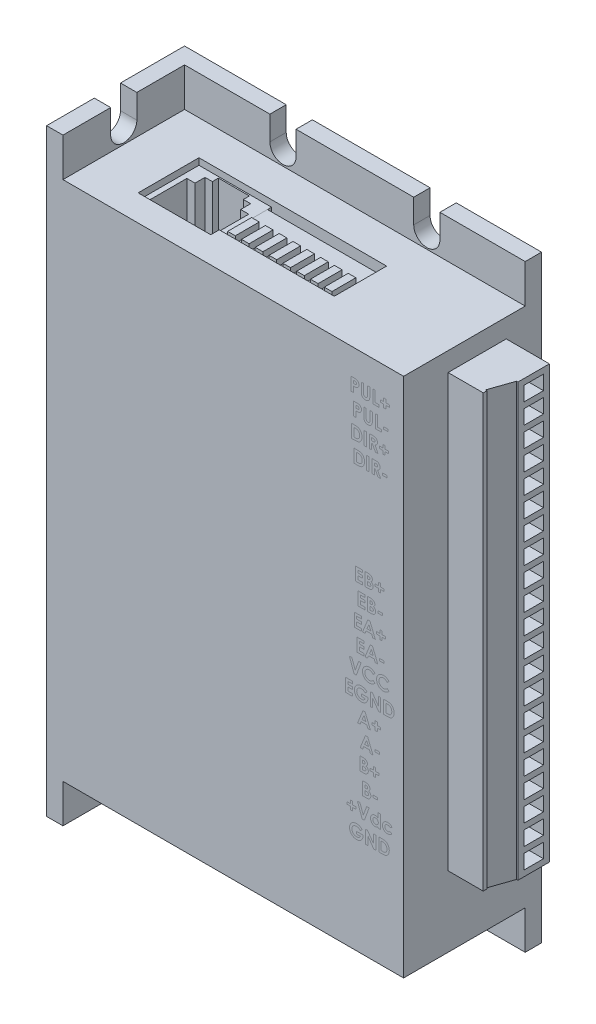
from build123d import *

# Parameters (mm, degrees)
SKETCH1_W             = 69.342
SKETCH1_H             = 116.205
BOSS_EXTRUDE1_DEPTH   = 26.797
SKETCH2_W             = 66.167
SKETCH2_H             = 7.493
CUT_EXTRUDE1_DEPTH    = 23.622
CUT_EXTRUDE2_DEPTH    = 93.043748317
CUT_EXTRUDE3_DEPTH    = 72.665735406
SKETCH5_W             = 14.097
SKETCH5_H             = 11.811
CUT_EXTRUDE4_DEPTH    = 12.7
SKETCH6_W             = 22.352
SKETCH6_H             = 10.16
CUT_EXTRUDE5_DEPTH    = 2.54
SKETCH7_W             = 22.352
SKETCH7_H             = 9.365891057
BOSS_EXTRUDE2_DEPTH   = 1.27
SKETCH8_W             = 1.48713728
SKETCH8_H             = 4.653093647
BOSS_EXTRUDE3_DEPTH   = 1.27
SKETCH8_W_2           = 1.487137279
BOSS_EXTRUDE3_2_DEPTH = 1.27
BOSS_EXTRUDE3_3_DEPTH = 1.27
BOSS_EXTRUDE3_4_DEPTH = 1.27
BOSS_EXTRUDE3_5_DEPTH = 1.27
BOSS_EXTRUDE3_6_DEPTH = 1.27
BOSS_EXTRUDE3_7_DEPTH = 1.27
BOSS_EXTRUDE3_8_DEPTH = 1.27
SKETCH9_W             = 14.097
SKETCH9_H             = 11.811
BOSS_EXTRUDE4_DEPTH   = 11.43
SKETCH10_W            = 11.303
SKETCH10_H            = 83.82
CUT_EXTRUDE6_DEPTH    = 5.08
BOSS_EXTRUDE5_DEPTH   = 83.82
SKETCH12_W            = 3.81
SKETCH12_H            = 2.794
CUT_EXTRUDE7_DEPTH    = 5.08


with BuildPart() as part:
    # Sketch1 → Boss-Extrude1 (new body)
    with BuildSketch(Plane.XY):
        Rectangle(SKETCH1_W, SKETCH1_H)
    extrude(amount=BOSS_EXTRUDE1_DEPTH)

    # Sketch2 → Cut-Extrude1 (cut)
    with BuildSketch(Plane.XY.offset(26.797)):
        with Locations((1.5875, 54.356)):
            Rectangle(SKETCH2_W, SKETCH2_H)
        with Locations((1.5875, -54.356)):
            Rectangle(SKETCH2_W, SKETCH2_H)
    extrude(amount=-CUT_EXTRUDE1_DEPTH, mode=Mode.SUBTRACT)

    # Sketch3 → Cut-Extrude2 (cut, through all)
    with BuildSketch(Plane(origin=(-31.496, 0, 0), x_dir=(0, 0, -1), z_dir=(1, 0, 0))):
        with BuildLine():
            Line((-12.446, 62.764217528), (-12.446, 53.440782472))
            ThreePointArc((-12.446, 53.440782472), (-14.986, 50.900782472), (-17.526, 53.440782472))
            Line((-17.526, 53.440782472), (-17.526, 62.764217528))
            ThreePointArc((-17.526, 62.764217528), (-14.986, 65.304217528), (-12.446, 62.764217528))
        make_face()
        with BuildLine():
            Line((-12.446, -62.764217528), (-12.446, -53.440782472))
            ThreePointArc((-12.446, -53.440782472), (-14.986, -50.900782472), (-17.526, -53.440782472))
            Line((-17.526, -53.440782472), (-17.526, -62.764217528))
            ThreePointArc((-17.526, -62.764217528), (-14.986, -65.304217528), (-12.446, -62.764217528))
        make_face()
    extrude(amount=-CUT_EXTRUDE2_DEPTH, mode=Mode.SUBTRACT)

    # Sketch4 → Cut-Extrude3 (cut, through all)
    with BuildSketch(Plane.XY.offset(3.175)):
        with BuildLine():
            Line((-9.8425, 62.7634), (-9.8425, 53.4416))
            ThreePointArc((-9.8425, 53.4416), (-12.3825, 50.9016), (-14.9225, 53.4416))
            Line((-14.9225, 53.4416), (-14.9225, 62.7634))
            ThreePointArc((-14.9225, 62.7634), (-12.3825, 65.3034), (-9.8425, 62.7634))
        make_face()
        with BuildLine():
            Line((13.0175, 62.7634), (13.0175, 53.4416))
            ThreePointArc((13.0175, 53.4416), (15.5575, 50.9016), (18.0975, 53.4416))
            Line((18.0975, 53.4416), (18.0975, 62.7634))
            ThreePointArc((18.0975, 62.7634), (15.5575, 65.3034), (13.0175, 62.7634))
        make_face()
        with BuildLine():
            Line((13.0175, -62.7634), (13.0175, -53.4416))
            ThreePointArc((13.0175, -53.4416), (15.5575, -50.9016), (18.0975, -53.4416))
            Line((18.0975, -53.4416), (18.0975, -62.7634))
            ThreePointArc((18.0975, -62.7634), (15.5575, -65.3034), (13.0175, -62.7634))
        make_face()
        with BuildLine():
            Line((-9.8425, -62.7634), (-9.8425, -53.4416))
            ThreePointArc((-9.8425, -53.4416), (-12.3825, -50.9016), (-14.9225, -53.4416))
            Line((-14.9225, -53.4416), (-14.9225, -62.7634))
            ThreePointArc((-14.9225, -62.7634), (-12.3825, -65.3034), (-9.8425, -62.7634))
        make_face()
    extrude(amount=-CUT_EXTRUDE3_DEPTH, mode=Mode.SUBTRACT)

    # Sketch5 → Cut-Extrude4 (cut)
    with BuildSketch(Plane(origin=(0, 50.6095, 0), x_dir=(1, 0, 0), z_dir=(0, 1, 0))):
        with Locations((-14.9225, -15.8115)):
            Rectangle(SKETCH5_W, SKETCH5_H)
    extrude(amount=-CUT_EXTRUDE4_DEPTH, mode=Mode.SUBTRACT)

    # Sketch6 → Cut-Extrude5 (cut)
    with BuildSketch(Plane(origin=(0, 50.6095, 0), x_dir=(1, 0, 0), z_dir=(0, 1, 0))):
        with Locations((3.302, -14.986)):
            Rectangle(SKETCH6_W, SKETCH6_H)
    extrude(amount=-CUT_EXTRUDE5_DEPTH, mode=Mode.SUBTRACT)

    # Sketch10 → Cut-Extrude6 (cut)
    with BuildSketch(Plane(origin=(34.671, 0, 0), x_dir=(0, 0, -1), z_dir=(1, 0, 0))):
        with Locations((-12.5095, 5.0165)):
            Rectangle(SKETCH10_W, SKETCH10_H)
    extrude(amount=-CUT_EXTRUDE6_DEPTH, mode=Mode.SUBTRACT)


with BuildPart() as body_2:
    # Sketch7 → Boss-Extrude2 (new body)
    with BuildSketch(Plane(origin=(0, 48.0695, 0), x_dir=(1, 0, 0), z_dir=(0, 1, 0))):
        with Locations((3.302, -15.383054472)):
            Rectangle(SKETCH7_W, SKETCH7_H)
    extrude(amount=BOSS_EXTRUDE2_DEPTH)


with BuildPart() as body_3:
    # Sketch8 → Boss-Extrude3 (new body)
    with BuildSketch(Plane(origin=(0, 49.3395, 0), x_dir=(1, 0, 0), z_dir=(0, 1, 0))):
        with Locations((-3.375429754, -17.178323812)):
            Rectangle(SKETCH8_W, SKETCH8_H)
    extrude(amount=BOSS_EXTRUDE3_DEPTH)


with BuildPart() as body_4:
    # Sketch8 → Boss-Extrude3 2 (new body)
    with BuildSketch(Plane(origin=(0, 49.3395, 0), x_dir=(1, 0, 0), z_dir=(0, 1, 0))):
        with Locations((-6.056553119, -17.178323812)):
            Rectangle(SKETCH8_W_2, SKETCH8_H)
    extrude(amount=BOSS_EXTRUDE3_2_DEPTH)


with BuildPart() as body_5:
    # Sketch8 → Boss-Extrude3 3 (new body)
    with BuildSketch(Plane(origin=(0, 49.3395, 0), x_dir=(1, 0, 0), z_dir=(0, 1, 0))):
        with Locations((-0.694306389, -17.178323812)):
            Rectangle(SKETCH8_W, SKETCH8_H)
    extrude(amount=BOSS_EXTRUDE3_3_DEPTH)


with BuildPart() as body_6:
    # Sketch8 → Boss-Extrude3 4 (new body)
    with BuildSketch(Plane(origin=(0, 49.3395, 0), x_dir=(1, 0, 0), z_dir=(0, 1, 0))):
        with Locations((1.986816976, -17.178323812)):
            Rectangle(SKETCH8_W, SKETCH8_H)
    extrude(amount=BOSS_EXTRUDE3_4_DEPTH)


with BuildPart() as body_7:
    # Sketch8 → Boss-Extrude3 5 (new body)
    with BuildSketch(Plane(origin=(0, 49.3395, 0), x_dir=(1, 0, 0), z_dir=(0, 1, 0))):
        with Locations((4.667940341, -17.178323812)):
            Rectangle(SKETCH8_W, SKETCH8_H)
    extrude(amount=BOSS_EXTRUDE3_5_DEPTH)


with BuildPart() as body_8:
    # Sketch8 → Boss-Extrude3 6 (new body)
    with BuildSketch(Plane(origin=(0, 49.3395, 0), x_dir=(1, 0, 0), z_dir=(0, 1, 0))):
        with Locations((7.349063706, -17.178323812)):
            Rectangle(SKETCH8_W_2, SKETCH8_H)
    extrude(amount=BOSS_EXTRUDE3_6_DEPTH)


with BuildPart() as body_9:
    # Sketch8 → Boss-Extrude3 7 (new body)
    with BuildSketch(Plane(origin=(0, 49.3395, 0), x_dir=(1, 0, 0), z_dir=(0, 1, 0))):
        with Locations((10.030187071, -17.178323812)):
            Rectangle(SKETCH8_W_2, SKETCH8_H)
    extrude(amount=BOSS_EXTRUDE3_7_DEPTH)


with BuildPart() as body_10:
    # Sketch8 → Boss-Extrude3 8 (new body)
    with BuildSketch(Plane(origin=(0, 49.3395, 0), x_dir=(1, 0, 0), z_dir=(0, 1, 0))):
        with Locations((12.711310435, -17.178323812)):
            Rectangle(SKETCH8_W_2, SKETCH8_H)
    extrude(amount=BOSS_EXTRUDE3_8_DEPTH)


with BuildPart() as body_11:
    # Sketch9 → Boss-Extrude4 (new body)
    with BuildSketch(Plane(origin=(0, 37.9095, 0), x_dir=(1, 0, 0), z_dir=(0, 1, 0))):
        with Locations((-14.9225, -15.8115)):
            Rectangle(SKETCH9_W, SKETCH9_H)
        Polygon((-8.905485398, -20.846059317), (-20.939514602, -20.846059317), (-20.939514602, -13.290564358), (-19.356458515, -13.290564358), (-19.356458515, -11.347722797), (-17.931007301, -11.347722797), (-17.931007301, -10.168950667), (-11.913992699, -10.168950667), (-11.913992699, -11.347722797), (-10.488541485, -11.347722797), (-10.488541485, -13.290564358), (-8.905485398, -13.290564358), align=None, mode=Mode.SUBTRACT)
    extrude(amount=BOSS_EXTRUDE4_DEPTH)


with BuildPart() as body_12:
    # Sketch11 → Boss-Extrude5 (new body)
    with BuildSketch(Plane.XZ.offset(-46.9265)):
        Polygon((34.671, 18.161), (41.50742493, 18.161), (41.50742493, 17.443094397), (41.230333252, 17.443094397), (42.786309598, 12.954), (43.053, 12.954), (43.053, 6.858), (34.671, 6.858), align=None)
    extrude(amount=BOSS_EXTRUDE5_DEPTH)

    # Sketch12 → Cut-Extrude7 (cut)
    with BuildSketch(Plane(origin=(43.053, 0, 0), x_dir=(0, 0, -1), z_dir=(1, 0, 0))):
        with Locations((-9.906, 40.4495)):
            Rectangle(SKETCH12_W, SKETCH12_H)
        with Locations((-9.906, 44.3865)):
            Rectangle(SKETCH12_W, SKETCH12_H)
        with Locations((-9.906, 36.5125)):
            Rectangle(SKETCH12_W, SKETCH12_H)
        with Locations((-9.906, 32.5755)):
            Rectangle(SKETCH12_W, SKETCH12_H)
        with Locations((-9.906, 28.6385)):
            Rectangle(SKETCH12_W, SKETCH12_H)
        with Locations((-9.906, 24.7015)):
            Rectangle(SKETCH12_W, SKETCH12_H)
        with Locations((-9.906, 20.7645)):
            Rectangle(SKETCH12_W, SKETCH12_H)
        with Locations((-9.906, 16.8275)):
            Rectangle(SKETCH12_W, SKETCH12_H)
        with Locations((-9.906, 12.8905)):
            Rectangle(SKETCH12_W, SKETCH12_H)
        with Locations((-9.906, 8.9535)):
            Rectangle(SKETCH12_W, SKETCH12_H)
        with Locations((-9.906, 5.0165)):
            Rectangle(SKETCH12_W, SKETCH12_H)
        with Locations((-9.906, 1.0795)):
            Rectangle(SKETCH12_W, SKETCH12_H)
        with Locations((-9.906, -2.8575)):
            Rectangle(SKETCH12_W, SKETCH12_H)
        with Locations((-9.906, -6.7945)):
            Rectangle(SKETCH12_W, SKETCH12_H)
        with Locations((-9.906, -10.7315)):
            Rectangle(SKETCH12_W, SKETCH12_H)
        with Locations((-9.906, -14.6685)):
            Rectangle(SKETCH12_W, SKETCH12_H)
        with Locations((-9.906, -18.6055)):
            Rectangle(SKETCH12_W, SKETCH12_H)
        with Locations((-9.906, -22.5425)):
            Rectangle(SKETCH12_W, SKETCH12_H)
        with Locations((-9.906, -26.4795)):
            Rectangle(SKETCH12_W, SKETCH12_H)
        with Locations((-9.906, -30.4165)):
            Rectangle(SKETCH12_W, SKETCH12_H)
        with Locations((-9.906, -34.3535)):
            Rectangle(SKETCH12_W, SKETCH12_H)
    extrude(amount=-CUT_EXTRUDE7_DEPTH, mode=Mode.SUBTRACT)


solid = Compound([part.part, body_2.part, body_3.part, body_4.part, body_5.part, body_6.part, body_7.part, body_8.part, body_9.part, body_10.part, body_11.part, body_12.part])
